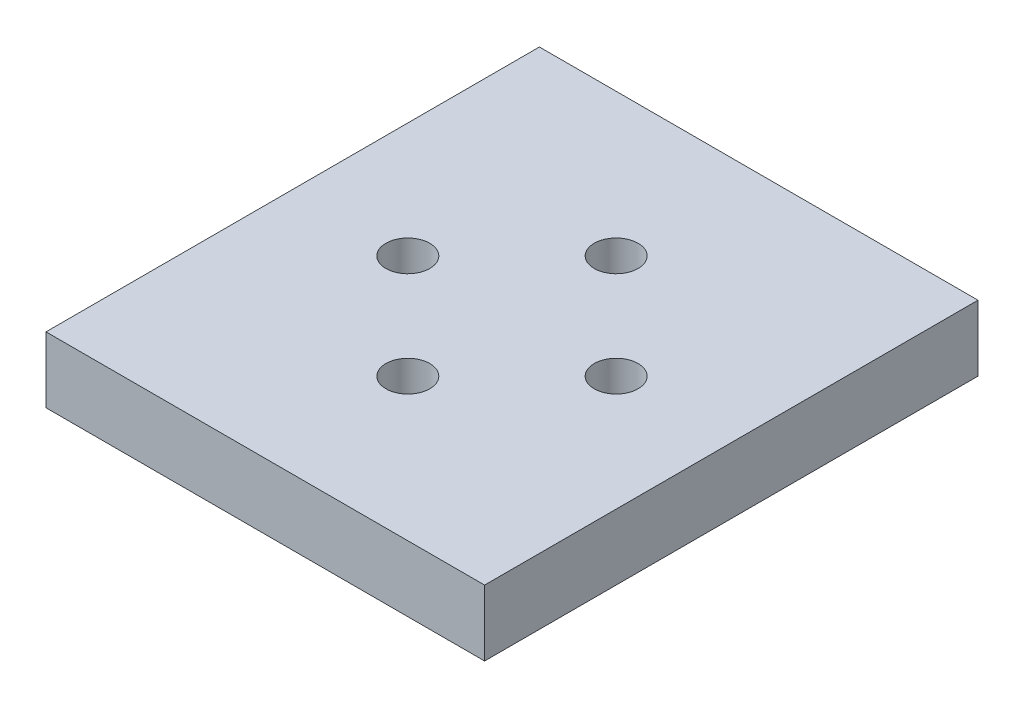
from build123d import *

# Parameters (mm, degrees)
SKETCH1_W           = 40
SKETCH1_H           = 45
BOSS_EXTRUDE1_DEPTH = 6
SKETCH2_R           = 2
CUT_EXTRUDE1_DEPTH  = 6


with BuildPart() as part:
    # Sketch1 → Boss-Extrude1 (new body)
    with BuildSketch(Plane(origin=(0, 0, 0), x_dir=(1, 0, 0), z_dir=(0, 1, 0))):
        Rectangle(SKETCH1_W, SKETCH1_H)
    extrude(amount=BOSS_EXTRUDE1_DEPTH)

    # Sketch2 → Cut-Extrude1 (cut)
    with BuildSketch(Plane(origin=(0, 6, 0), x_dir=(1, 0, 0), z_dir=(0, 1, 0))):
        with Locations(Location((0, 9.5, 0), (0, 0, 270))):
            Circle(SKETCH2_R)
        with Locations(Location((9.5, 0, 0), (0, 0, 270))):
            Circle(SKETCH2_R)
        with Locations(Location((0, -9.5, 0), (0, 0, 270))):
            Circle(SKETCH2_R)
        with Locations(Location((-9.5, 0, 0), (0, 0, 270))):
            Circle(SKETCH2_R)
    extrude(amount=-CUT_EXTRUDE1_DEPTH, mode=Mode.SUBTRACT)


solid = part.part
